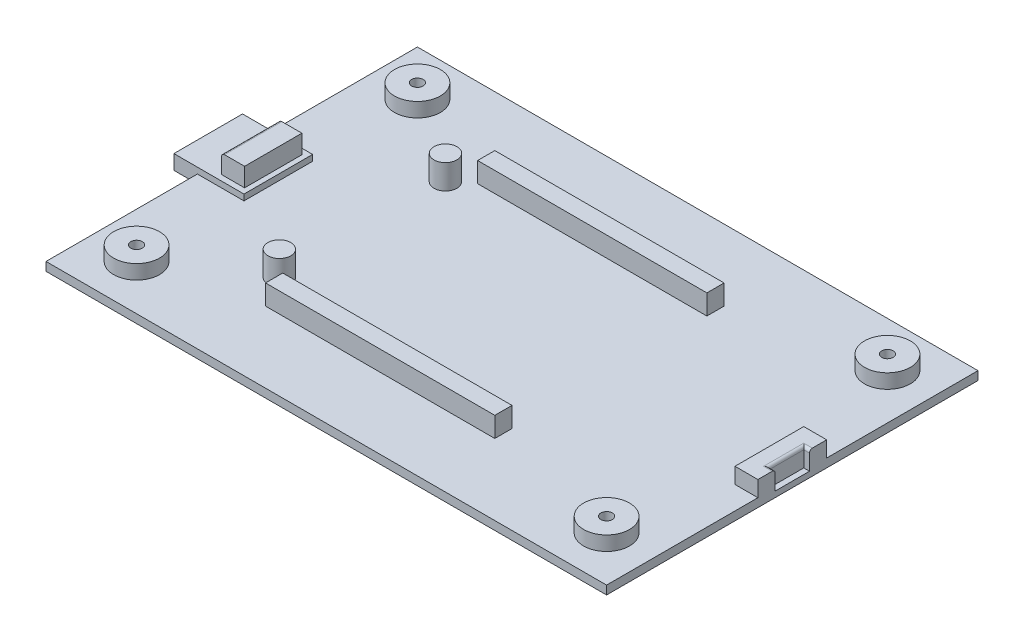
from build123d import *

# Parameters (mm, degrees)
EXTRUDE_1_DEPTH     = 1.5
SKETCH_2_R          = 5
CUT_EXTRUDE_1_DEPTH = 0.5
SKETCH_11_R         = 2
SKETCH_11_W         = 12.230000073
SKETCH_11_H         = 11.974599949
EXTRUDE_5_DEPTH     = 2.539974634
SKETCH_13_R         = 2
SKETCH_13_W         = 4
SKETCH_13_H         = 10
TYPEC_2_DEPTH       = 5.7999746
LED_3_START         = -4.25
LED_3_DEPTH         = 2.75
LED_1_R             = 0.5
CUT_EXTRUDE_2_REACH = 75.743
SKETCH_15_R         = 2
EXTRUDE_START       = -4
SKETCH_16_R         = 4
SKETCH_16_R_2       = 1
EXTRUDE_4_DEPTH     = 2.5
LED_2_START         = -1.5
SKETCH_17_W         = 1
SKETCH_17_H         = 6
LED_2_DEPTH         = 0.5
SKETCH_18_W         = 40
SKETCH_18_H         = 3
EXTRUDE_2_DEPTH     = 3.5


with BuildPart() as part:
    # 草图1 → 凸台-拉伸1 (new body)
    with BuildSketch(Plane(origin=(0, 0, 0), x_dir=(1, 0, 0), z_dir=(0, 1, 0))):
        Polygon((-51.714401712, -9.454370264), (-55.816720774, -9.454370264), (-55.816720774, -21.428970213), (-51.714401712, -21.428970213), (-51.714401712, -47.841670238), (46.085598288, -47.841670238), (46.085598288, 16.958329762), (-51.714401712, 16.958329762), align=None)
    extrude(amount=EXTRUDE_1_DEPTH)

    # 草图2 → 防滑切除-拉伸1 (cut)
    with BuildSketch(Plane.XZ):
        with Locations(Location((-43.814401712, -9.058329762, 0), (0, 0, 270))):
            Circle(SKETCH_2_R)
        with Locations(Location((-43.814401712, 39.941670238, 0), (0, 0, 270))):
            Circle(SKETCH_2_R)
        with Locations(Location((38.185598288, 39.941670238, 0), (0, 0, 90))):
            Circle(SKETCH_2_R)
        with Locations(Location((38.185598288, -9.058329762, 0), (0, 0, 90))):
            Circle(SKETCH_2_R)
    extrude(amount=-CUT_EXTRUDE_1_DEPTH, mode=Mode.SUBTRACT)

    # 草图11 → 充电板档板凸台-拉伸5 (add)
    with BuildSketch(Plane.XZ):
        with Locations((-28.914401712, 29.928970213)):
            Circle(SKETCH_11_R)
        with Locations((-28.914401712, 0.954370264)):
            Circle(SKETCH_11_R)
        with Locations((-49.701720738, 15.441670239)):
            Rectangle(SKETCH_11_W, SKETCH_11_H)
    extrude(amount=-EXTRUDE_5_DEPTH)

    # 草图13 → TypeC支撑凸台-拉伸2 (add)
    with BuildSketch(Plane.XZ):
        with Locations(Location((-28.914401712, 29.928970213, 0), (0, 0, 90))):
            Circle(SKETCH_13_R)
        with Locations(Location((-28.914401712, 0.954370264, 0), (0, 0, 90))):
            Circle(SKETCH_13_R)
        with Locations((-46.466720701, 15.441670238)):
            Rectangle(SKETCH_13_W, SKETCH_13_H)
    extrude(amount=-TYPEC_2_DEPTH)

    # 草图14 → LED限位凸台-拉伸3 (add)
    with BuildSketch(Plane.XZ.offset(LED_3_START)):
        Polygon((45.085598288, 12.441670238), (45.085598288, 18.441670238), (46.085598288, 18.441670238), (46.085598288, 21.441670238), (42.085598288, 21.441670238), (42.085598288, 9.441670238), (46.085598288, 9.441670238), (46.085598288, 12.441670238), align=None)
    extrude(amount=LED_3_DEPTH)

    # LED限位圆角1
    led_1_edges = [part.edges().sort_by_distance(p)[0] for p in [
        (45.585598288, 4.25, 18.441670238),
        (45.585598288, 4.25, 12.441670238),
        (45.085598288, 4.25, 15.441670238),
        (-48.466720701, 5.7999746, 15.441670238),
    ]]
    fillet(led_1_edges, radius=LED_1_R)

    # 草图15 → 螺丝孔位切除-拉伸2 (cut, up to next)
    with BuildSketch(Plane.XZ, mode=Mode.PRIVATE) as cut_extrude_2_sk1:
        with Locations(Location((-43.814401712, -9.058329762, 0), (0, 0, 270))):
            Circle(SKETCH_15_R)
    cut_extrude_2_tool1 = extrude(cut_extrude_2_sk1.sketch, amount=-CUT_EXTRUDE_2_REACH, mode=Mode.PRIVATE) & part.part
    # 草图15 → 螺丝孔位切除-拉伸2 (cut, up to next)
    with BuildSketch(Plane.XZ, mode=Mode.PRIVATE) as cut_extrude_2_sk2:
        with Locations(Location((-43.814401712, 39.941670238, 0), (0, 0, 270))):
            Circle(SKETCH_15_R)
    cut_extrude_2_tool2 = extrude(cut_extrude_2_sk2.sketch, amount=-CUT_EXTRUDE_2_REACH, mode=Mode.PRIVATE) & part.part
    # 草图15 → 螺丝孔位切除-拉伸2 (cut, up to next)
    with BuildSketch(Plane.XZ, mode=Mode.PRIVATE) as cut_extrude_2_sk3:
        with Locations(Location((38.185598288, -9.058329762, 0), (0, 0, 270))):
            Circle(SKETCH_15_R)
    cut_extrude_2_tool3 = extrude(cut_extrude_2_sk3.sketch, amount=-CUT_EXTRUDE_2_REACH, mode=Mode.PRIVATE) & part.part
    # 草图15 → 螺丝孔位切除-拉伸2 (cut, up to next)
    with BuildSketch(Plane.XZ, mode=Mode.PRIVATE) as cut_extrude_2_sk4:
        with Locations(Location((38.185598288, 39.941670238, 0), (0, 0, 270))):
            Circle(SKETCH_15_R)
    cut_extrude_2_tool4 = extrude(cut_extrude_2_sk4.sketch, amount=-CUT_EXTRUDE_2_REACH, mode=Mode.PRIVATE) & part.part
    add(cut_extrude_2_tool1.solids().sort_by_distance((-43.814402, 0, -9.05833))[0], mode=Mode.SUBTRACT)
    add(cut_extrude_2_tool2.solids().sort_by_distance((-43.814402, 0, 39.94167))[0], mode=Mode.SUBTRACT)
    add(cut_extrude_2_tool3.solids().sort_by_distance((38.185598, 0, -9.05833))[0], mode=Mode.SUBTRACT)
    add(cut_extrude_2_tool4.solids().sort_by_distance((38.185598, 0, 39.94167))[0], mode=Mode.SUBTRACT)

    # 草图16 → 螺丝孔凸台-拉伸4 (add)
    # profile 1 of 4: a face of its own
    with BuildSketch(Plane.XZ.offset(EXTRUDE_START)):
        with Locations((38.185598288, -9.058329762)):
            Circle(SKETCH_16_R)
        with Locations((38.185598288, -9.058329762)):
            Circle(SKETCH_16_R_2, mode=Mode.SUBTRACT)
    # profile 2 of 4: a face of its own
    with BuildSketch(Plane.XZ.offset(EXTRUDE_START)):
        with Locations((38.185598288, 39.941670238)):
            Circle(SKETCH_16_R)
        with Locations((38.185598288, 39.941670238)):
            Circle(SKETCH_16_R_2, mode=Mode.SUBTRACT)
    # profile 3 of 4: a face of its own
    with BuildSketch(Plane.XZ.offset(EXTRUDE_START)):
        with Locations((-43.814401712, -9.058329762)):
            Circle(SKETCH_16_R)
        with Locations((-43.814401712, -9.058329762)):
            Circle(SKETCH_16_R_2, mode=Mode.SUBTRACT)
    # profile 4 of 4: a face of its own
    with BuildSketch(Plane.XZ.offset(EXTRUDE_START)):
        with Locations((-43.814401712, 39.941670238)):
            Circle(SKETCH_16_R)
        with Locations((-43.814401712, 39.941670238)):
            Circle(SKETCH_16_R_2, mode=Mode.SUBTRACT)
    extrude(amount=EXTRUDE_4_DEPTH)

    # 草图17 → LED灯嵌入切除-拉伸2 (cut)
    with BuildSketch(Plane.XZ.offset(LED_2_START)):
        with Locations((45.585598288, 15.441670238)):
            Rectangle(SKETCH_17_W, SKETCH_17_H)
    extrude(amount=LED_2_DEPTH, mode=Mode.SUBTRACT)

    # 草图18 → 散热板支撑凸台-拉伸2 (add)
    with BuildSketch(Plane(origin=(0, 1.5, 0), x_dir=(1, 0, 0), z_dir=(0, 1, 0))):
        with Locations((-5.814401712, 3.058329762)):
            Rectangle(SKETCH_18_W, SKETCH_18_H)
        with Locations((-5.814401712, -33.941670238)):
            Rectangle(SKETCH_18_W, SKETCH_18_H)
    extrude(amount=EXTRUDE_2_DEPTH)


solid = part.part
